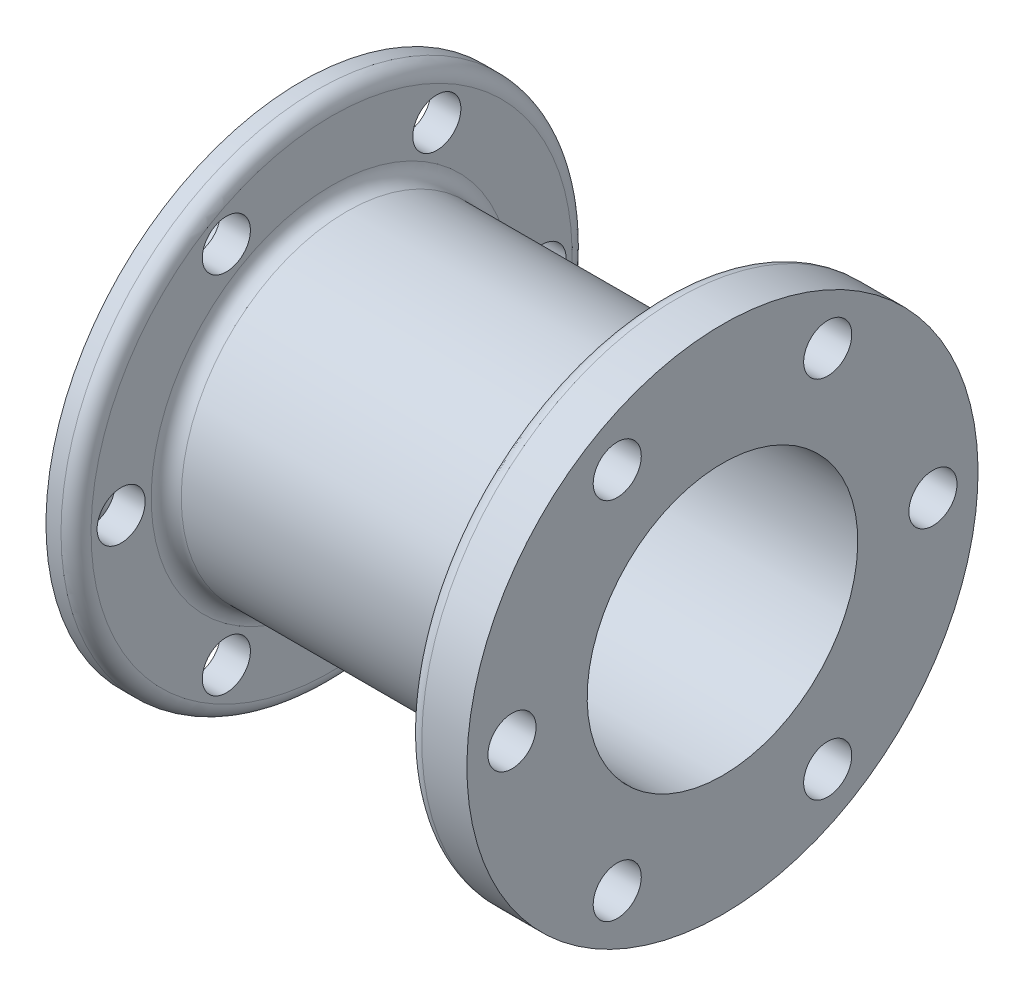
from build123d import *

# Parameters (mm, degrees)
FILLET1_R               = 5
CUT_EXTRUDE1_DEPTH      = 178.059312144
CUT_EXTRUDE1_DEPTH_BACK = 178.059312144
SKETCH2_R               = 8


with BuildPart() as part:
    # Sketch1 → Revolve1 (revolve)
    with BuildSketch(Plane.XY, mode=Mode.PRIVATE) as revolve1_sk:
        Polygon((-80, 55), (-80, 50), (-80, 39), (-75, 39), (-75, 45), (80, 45), (80, 85), (60, 85), (60, 55), (-50, 55), (-50, 85), (-60, 85), (-60, 55), align=None)
    revolve(revolve1_sk.sketch.rotate(Axis((-80, 0, 0), (1, 0, 0)), 180), axis=Axis((-80, 0, 0), (1, 0, 0)))

    # Fillet1
    fillet1_edges = [part.edges().sort_by_distance(p)[0] for p in [
        (-50, 85, 0),
        (-50, 55, 0),
        (60, 55, 0),
        (60, 85, 0),
    ]]
    fillet(fillet1_edges, radius=FILLET1_R)

    # Sketch2 → Cut-Extrude1 (cut, two sides: drawn at the far end of the back side and taken through both)
    with BuildSketch(Plane(origin=(-50, 0, 0), x_dir=(0, 0, -1), z_dir=(1, 0, 0)).offset(-CUT_EXTRUDE1_DEPTH_BACK)):
        with Locations(Location((70, 0, 0), (0, 0, 90))):
            Circle(SKETCH2_R)
        with Locations(Location((35, -60.621778265, 0), (0, 0, 90))):
            Circle(SKETCH2_R)
        with Locations(Location((-35, -60.621778265, 0), (0, 0, 90))):
            Circle(SKETCH2_R)
        with Locations(Location((-70, 0, 0), (0, 0, 90))):
            Circle(SKETCH2_R)
        with Locations(Location((-35, 60.621778265, 0), (0, 0, 90))):
            Circle(SKETCH2_R)
        with Locations(Location((35, 60.621778265, 0), (0, 0, 90))):
            Circle(SKETCH2_R)
    extrude(amount=CUT_EXTRUDE1_DEPTH + CUT_EXTRUDE1_DEPTH_BACK, mode=Mode.SUBTRACT)


solid = part.part
